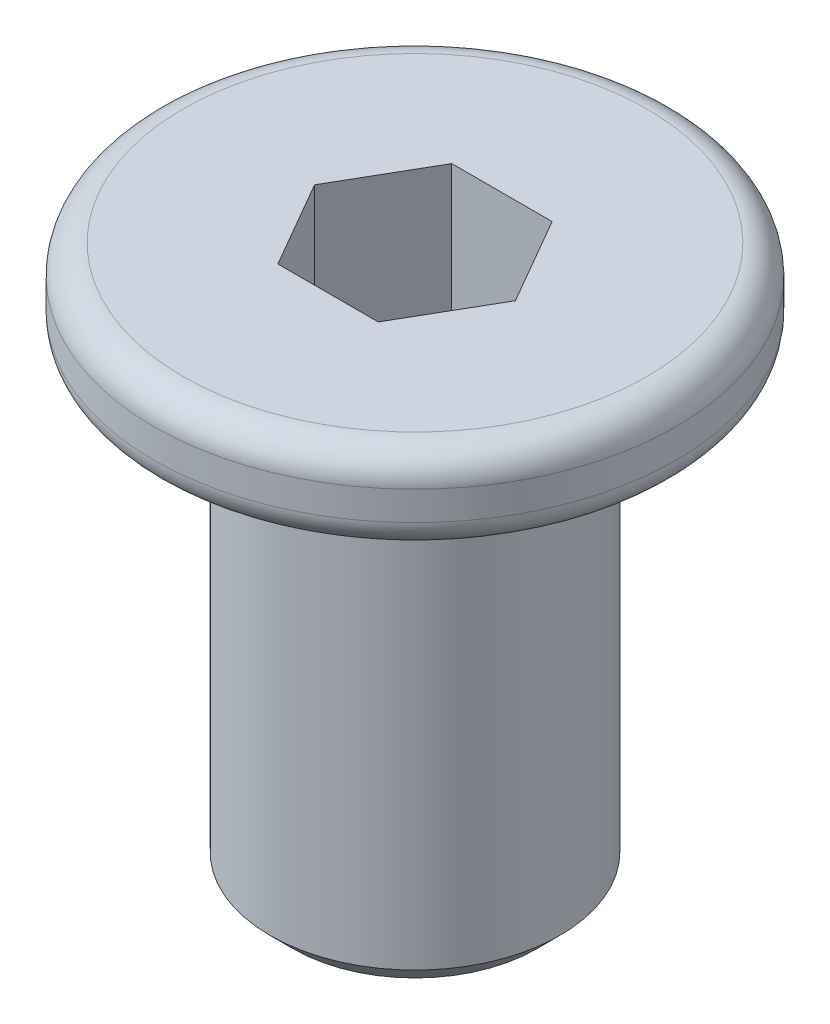
from build123d import *

# Parameters (mm, degrees)
CUT_EXTRUDE2_DEPTH = 3


with BuildPart() as part:
    # Sketch1 → Revolve1 (revolve)
    with BuildSketch(Plane.XY, mode=Mode.PRIVATE) as revolve1_sk:
        with BuildLine():
            Line((-4.5, -0.5), (-4.5, -1))
            ThreePointArc((-4.5, -1), (-4.353553391, -1.353553391), (-4, -1.5))
            Line((-4, -1.5), (-2.5, -1.5))
            Line((-2.5, -1.5), (-2.5, -9.1))
            Line((-2.5, -9.1), (-2.1, -9.5))
            Line((-2.1, -9.5), (0, -9.5))
            Line((0, -9.5), (0, -4))
            Line((0, -4), (-1.5, -3))
            Line((-1.5, -3), (-1.5, 0))
            Line((-1.5, 0), (-4, 0))
            ThreePointArc((-4, 0), (-4.353553391, -0.146446609), (-4.5, -0.5))
        make_face()
    revolve(revolve1_sk.sketch.rotate(Axis((0, 2.75, 0), (0, -1, 0)), 270), axis=Axis((0, 2.75, 0), (0, -1, 0)))

    # Sketch3 → Cut-Extrude2 (cut)
    with BuildSketch(Plane(origin=(0, 0, 0), x_dir=(1, 0, 0), z_dir=(0, 1, 0))):
        Polygon((-0.866025404, -1.5), (0.866025404, -1.5), (1.732050808, 0), (0.866025404, 1.5), (-0.866025404, 1.5), (-1.732050808, 0), align=None)
    extrude(amount=-CUT_EXTRUDE2_DEPTH, mode=Mode.SUBTRACT)


solid = part.part
